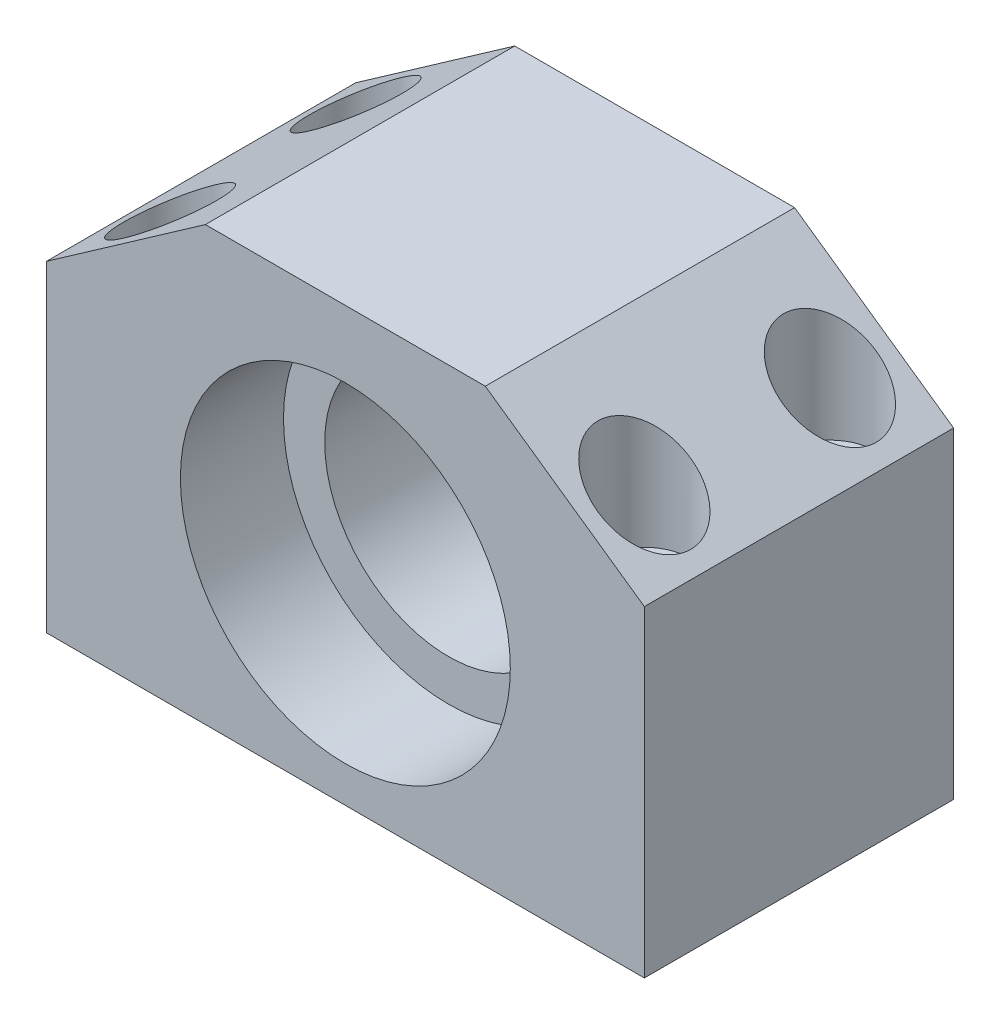
from build123d import *

# Parameters (mm, degrees)
SZKIC1_W                                             = 58
SZKIC1_H                                             = 30
DODANIE_WYCI_GNI_CIE1_DEPTH                          = 42
SZKIC3_R                                             = 12
WYTNIJ_WYCI_GNI_CIE2_DEPTH                           = 60.203040462
SZKIC4_R                                             = 16
WYTNIJ_WYCI_GNI_CIE3_DEPTH                           = 10
POG_BIENIE_WALCOWE_POD_M5_WKR_T_DO_CZ_CI_D           = 5.5
POG_BIENIE_WALCOWE_POD_M5_WKR_T_DO_CZ_CI_CBORE_D     = 9
POG_BIENIE_WALCOWE_POD_M5_WKR_T_DO_CZ_CI_CBORE_DEPTH = 15
WYTNIJ_WYCI_GNI_CIE4_DEPTH                           = 60.203040462


with BuildPart() as part:
    # Szkic1 → Dodanie-wyciągnięcie1 (new body)
    with BuildSketch(Plane(origin=(0, 0, 0), x_dir=(1, 0, 0), z_dir=(0, 1, 0))):
        Rectangle(SZKIC1_W, SZKIC1_H)
    extrude(amount=DODANIE_WYCI_GNI_CIE1_DEPTH)

    # Szkic3 → Wytnij-wyciągnięcie2 (cut, through all)
    with BuildSketch(Plane.XY.offset(15)):
        with Locations((0, 19.5)):
            Circle(SZKIC3_R)
    extrude(amount=-WYTNIJ_WYCI_GNI_CIE2_DEPTH, mode=Mode.SUBTRACT)

    # Szkic4 → Wytnij-wyciągnięcie3 (cut)
    with BuildSketch(Plane.XY.offset(15)):
        with Locations((0, 19.5)):
            Circle(SZKIC4_R)
    wytnij_wyci_gni_cie3 = extrude(amount=-WYTNIJ_WYCI_GNI_CIE3_DEPTH, mode=Mode.SUBTRACT)

    # Lustro1: Wytnij-wyciągnięcie3 across plane
    add(wytnij_wyci_gni_cie3.mirror(Plane.XY), mode=Mode.SUBTRACT)

    # Pogłębienie walcowe pod M5 Wkręt do części metalowych z łbem sześciokątnym1 (through all)
    with Locations(Plane(origin=(0, 42, 0), x_dir=(1, 0, 0), z_dir=(0, 1, 0))):
        with Locations((-23, -9), (-23, 9), (23, -9), (23, 9)):
            CounterBoreHole(POG_BIENIE_WALCOWE_POD_M5_WKR_T_DO_CZ_CI_D / 2, POG_BIENIE_WALCOWE_POD_M5_WKR_T_DO_CZ_CI_CBORE_D / 2, POG_BIENIE_WALCOWE_POD_M5_WKR_T_DO_CZ_CI_CBORE_DEPTH)

    # Szkic10 → Wytnij-wyciągnięcie4 (cut, through all)
    with BuildSketch(Plane(origin=(0, 0, -15), x_dir=(-1, 0, 0), z_dir=(0, 0, -1))):
        Polygon((-29, 31.199169847), (-13.574815946, 42), (-29, 42), align=None)
        Polygon((13.574815946, 42), (29, 31.199169847), (29, 42), align=None)
    extrude(amount=-WYTNIJ_WYCI_GNI_CIE4_DEPTH, mode=Mode.SUBTRACT)


solid = part.part
